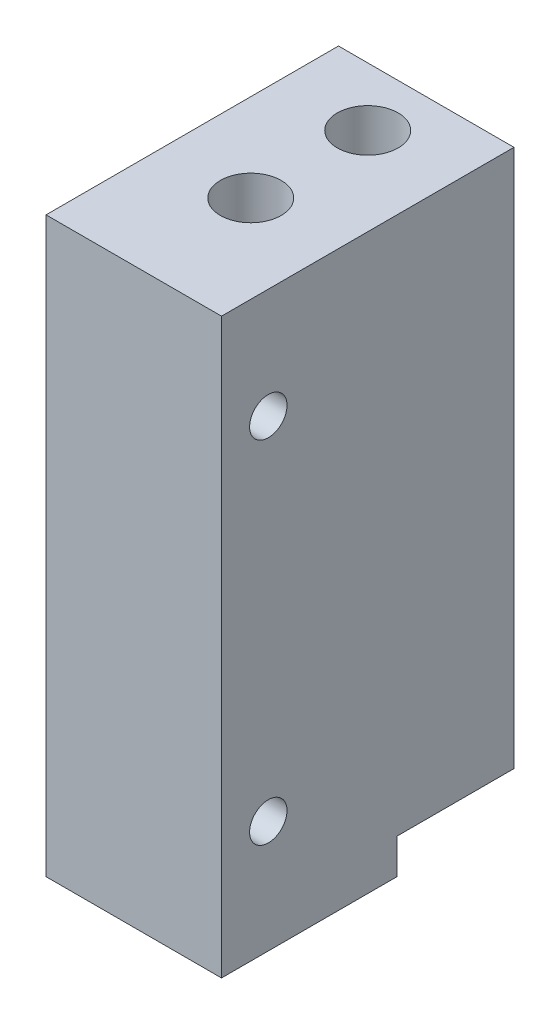
from build123d import *

# Parameters (mm, degrees)
SKETCH1_W           = 15
SKETCH1_H           = 49
SKETCH1_R           = 1.6
BOSS_EXTRUDE1_DEPTH = 15
SKETCH2_R           = 2.6
CUT_EXTRUDE1_DEPTH  = 54.394756297
SKETCH5_W           = 15
SKETCH5_H           = 46
BOSS_EXTRUDE3_DEPTH = 10
SKETCH6_R           = 2.6
CUT_EXTRUDE2_DEPTH  = 51.655700568


with BuildPart() as part:
    # Sketch1 → Boss-Extrude1 (new body)
    with BuildSketch(Plane(origin=(0, 0, 0), x_dir=(0, 0, -1), z_dir=(1, 0, 0))):
        with Locations((-7.5, 24.5)):
            Rectangle(SKETCH1_W, SKETCH1_H)
        with Locations((-11, 39.6)):
            Circle(SKETCH1_R, mode=Mode.SUBTRACT)
        with Locations((-11, 9.6)):
            Circle(SKETCH1_R, mode=Mode.SUBTRACT)
    extrude(amount=BOSS_EXTRUDE1_DEPTH)

    # Sketch2 → Cut-Extrude1 (cut, through all)
    with BuildSketch(Plane.XZ):
        with Locations(Location((7.5, 5, 0), (0, 0, 270))):
            Circle(SKETCH2_R)
    extrude(amount=-CUT_EXTRUDE1_DEPTH, mode=Mode.SUBTRACT)

    # Sketch5 → Boss-Extrude3 (add)
    with BuildSketch(Plane(origin=(0, 0, 0), x_dir=(-1, 0, 0), z_dir=(0, 0, -1))):
        with Locations((-7.5, 26)):
            Rectangle(SKETCH5_W, SKETCH5_H)
    extrude(amount=BOSS_EXTRUDE3_DEPTH)

    # Sketch6 → Cut-Extrude2 (cut, through all)
    with BuildSketch(Plane.XZ.offset(-3)):
        with Locations(Location((7.5, -5, 0), (0, 0, 270))):
            Circle(SKETCH6_R)
    extrude(amount=-CUT_EXTRUDE2_DEPTH, mode=Mode.SUBTRACT)


solid = part.part
